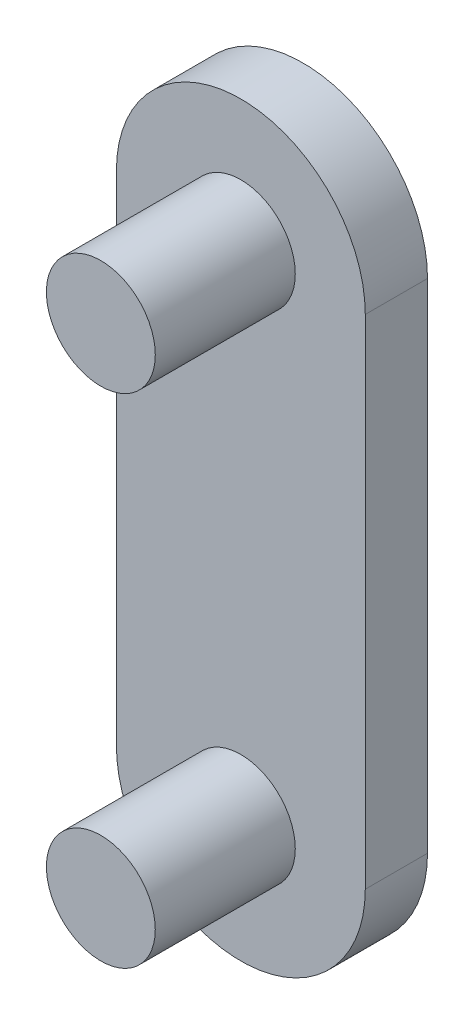
from build123d import *

# Parameters (mm, degrees)
BOSS_EXTRUDE1_DEPTH = 2
SKETCH1_4_R         = 1.75
BOSS_EXTRUDE2_DEPTH = 4.5


with BuildPart() as part:
    # Sketch1 → Boss-Extrude1 (new body)
    with BuildSketch(Plane.XY):
        with BuildLine():
            ThreePointArc((4, 0), (0, 4), (-4, 0))
            Line((-4, 0), (-4, -16))
            ThreePointArc((-4, -16), (0, -20), (4, -16))
            Line((4, -16), (4, 0))
        make_face()
    extrude(amount=-BOSS_EXTRUDE1_DEPTH)

    # Sketch1<4> → Boss-Extrude2 (add)
    with BuildSketch(Plane.XY):
        Circle(SKETCH1_4_R)
        with Locations((0, -16)):
            Circle(SKETCH1_4_R)
    extrude(amount=BOSS_EXTRUDE2_DEPTH)


solid = part.part
